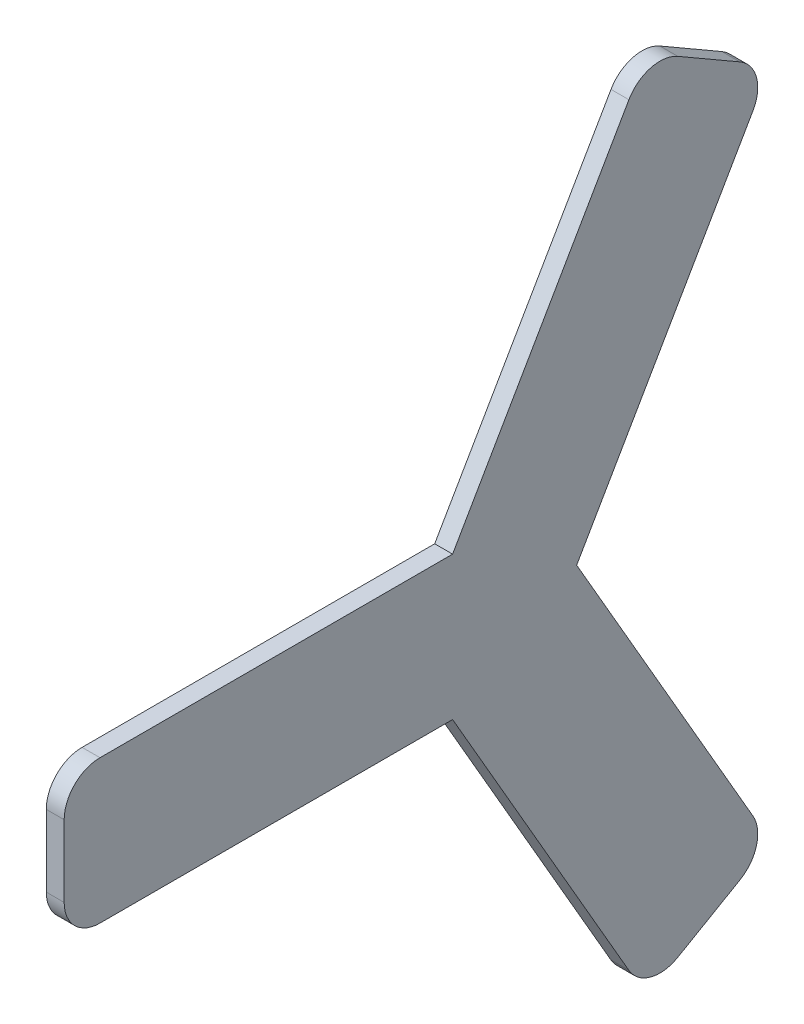
from build123d import *

# Parameters (mm, degrees)
SKETCH1_W                = 4
SKETCH1_H                = 12
EXTRUDE_THIN2_DEPTH      = 0.5
FILLET2_R                = 1
CIRPATTERN1_COUNT        = 3
FILLET2_OF_CIRPATTERN1_R = 1


with BuildPart() as part:
    # Sketch1 → Extrude-Thin2 (new body)
    with BuildSketch(Plane.YZ):
        with Locations((0, 6)):
            Rectangle(SKETCH1_W, SKETCH1_H)
    extrude_thin2 = extrude(amount=EXTRUDE_THIN2_DEPTH)

    # Fillet2
    fillet2_edges = [part.edges().sort_by_distance(p)[0] for p in [
        (0.25, -2, 12),
        (0.25, 2, 12),
    ]]
    fillet(fillet2_edges, radius=FILLET2_R)

    # CirPattern1: Extrude-Thin2 ×3 about axis
    cirpattern1_axis = Axis((0, 0, 0), (1, 0, 0))
    for i in range(1, CIRPATTERN1_COUNT):
        add(extrude_thin2.rotate(cirpattern1_axis, i * 360 / CIRPATTERN1_COUNT))

    # Fillet2 of CirPattern1
    fillet2_of_cirpattern1_edges = [part.edges().sort_by_distance(p)[0] for p in [
        (0.25, -9.392304845, -7.732050808),
        (0.25, -11.392304845, -4.267949192),
        (0.25, 11.392304845, -4.267949192),
        (0.25, 9.392304845, -7.732050808),
    ]]
    fillet(fillet2_of_cirpattern1_edges, radius=FILLET2_OF_CIRPATTERN1_R)


solid = part.part
